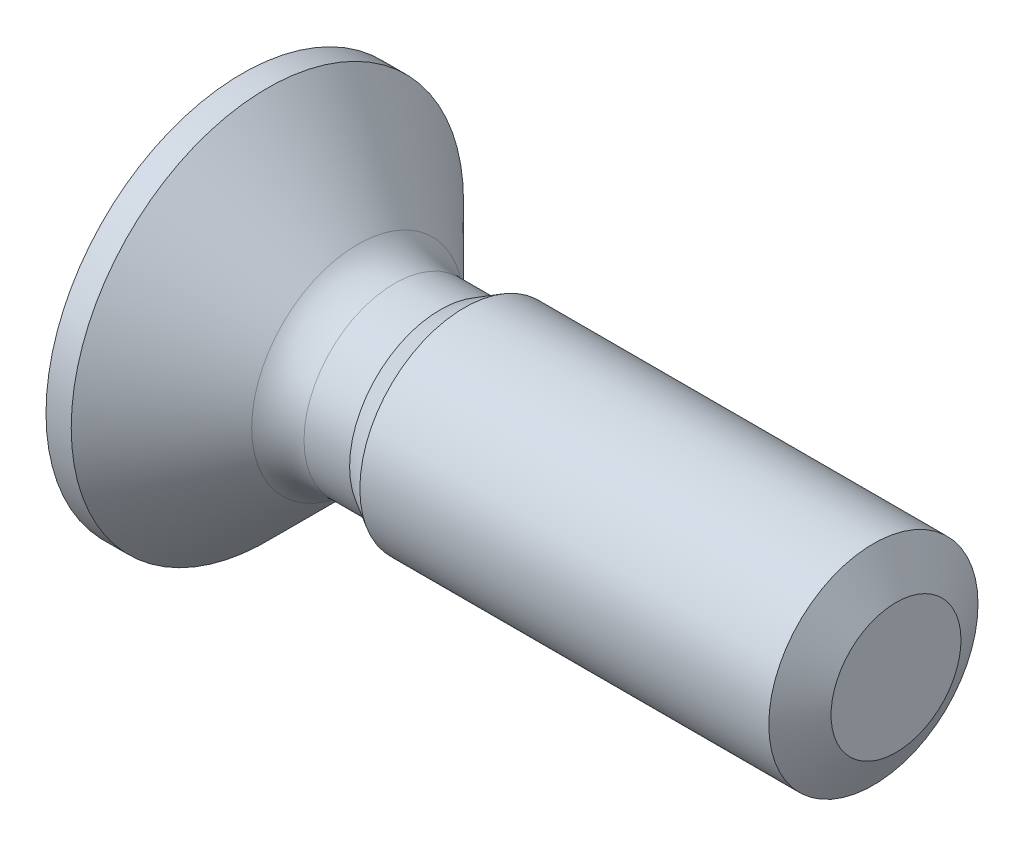
from build123d import *

# Parameters (mm, degrees)
PATTERN_CIRCULAR_1_COUNT = 2
PATTERN_CIRCULAR_1_ANGLE = 90


with BuildPart() as part:
    # 草图1 → Revolve 689 (revolve)
    with BuildSketch(Plane.XY, mode=Mode.PRIVATE) as revolve_689_sk:
        with BuildLine():
            Line((0, 0), (0, 1.5))
            Line((0, 1.5), (0.1928, 1.5))
            Line((0.1928, 1.5), (0.882842712, 0.809957288))
            ThreePointArc((0.882842712, 0.809957288), (1.012612052, 0.723248187), (1.165685425, 0.6928))
            Line((1.165685425, 0.6928), (1.514324153, 0.6928))
            Line((1.514324153, 0.6928), (1.7, 0.8))
            Line((1.7, 0.8), (5, 0.8))
            Line((5, 0.8), (5, 0))
            Line((5, 0), (0, 0))
        make_face()
    revolve(revolve_689_sk.sketch.rotate(Axis((0, 0, 0), (1, 0, 0)), 90), axis=Axis((0, 0, 0), (1, 0, 0)))

    # 草图2 → 切除-旋转1 (revolve, cut)
    with BuildSketch(Plane.XY, mode=Mode.PRIVATE) as cut_revolve_1_sk:
        Polygon((4.826895602, 0.8), (5.176895602, 0.8), (5, 0.4969), align=None)
    revolve(cut_revolve_1_sk.sketch.rotate(Axis((0, 0, 0), (-1, 0, 0)), 270), axis=Axis((0, 0, 0), (-1, 0, 0)), mode=Mode.SUBTRACT)

    # 草图3 → 切除-放样1 section 0
    with BuildSketch(Plane.ZY, mode=Mode.PRIVATE) as loft_1_s0:
        with BuildLine():
            Line((-0.8, 0.175), (0.8, 0.175))
            Line((0.8, 0.175), (0.8, -0.175))
            Line((0.8, -0.175), (-0.8, -0.175))
            Line((-0.8, -0.175), (-0.8, 0.175))
        make_face()
    loft_1 = loft([loft_1_s0.sketch, Vertex(0.9, 0, 0)], mode=Mode.SUBTRACT)

    # 阵列(圆周)1: 切除-放样1 ×2 about axis
    pattern_circular_1_axis = Axis((0, 0, 0), (1, 0, 0))
    for i in range(1, PATTERN_CIRCULAR_1_COUNT):
        add(loft_1.rotate(pattern_circular_1_axis, i * PATTERN_CIRCULAR_1_ANGLE / (PATTERN_CIRCULAR_1_COUNT - 1)), mode=Mode.SUBTRACT)


solid = part.part
